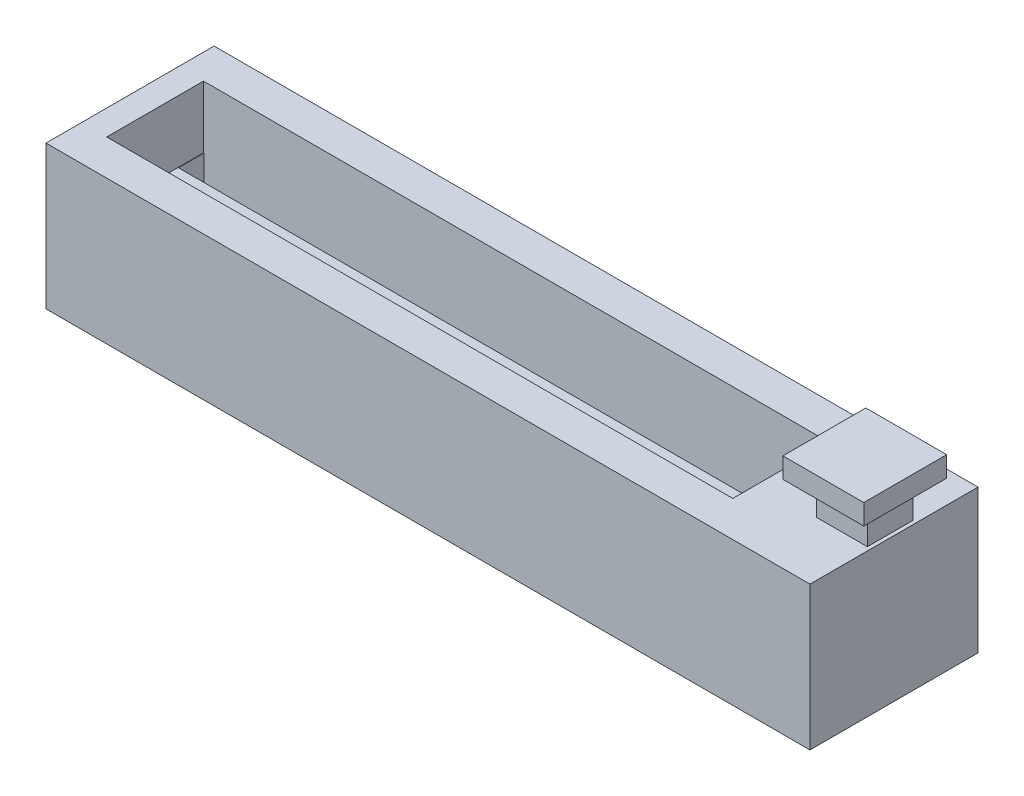
from build123d import *

# Parameters (mm, degrees)
BOSS_EXTRUDE1_DEPTH  = 13
CUT_EXTRUDE1_DEPTH   = 66.5
BOSS_EXTRUDE4_DEPTH  = 6.1
CUT_EXTRUDE2_DEPTH   = 6.1
BOSS_EXTRUDE6_DEPTH  = 2.5
BOSS_EXTRUDE7_DEPTH  = 2.5
BOSS_EXTRUDE8_DEPTH  = 19.1
BOSS_EXTRUDE12_DEPTH = 9.5
BOSS_EXTRUDE13_DEPTH = 2.5
CUT_EXTRUDE4_DEPTH   = 5
CUT_EXTRUDE5_DEPTH   = 6.5
BOSS_EXTRUDE14_DEPTH = 10
CUT_EXTRUDE7_DEPTH   = 13
CUT_EXTRUDE8_DEPTH   = 5
CUT_EXTRUDE9_DEPTH   = 5
BOSS_EXTRUDE15_DEPTH = 2


with BuildPart() as part:
    # 3DSketch1 → Boss-Extrude1 (new body)
    with BuildSketch(Plane(origin=(0, 0, 0), x_dir=(0.970570246541768, 0, 0.2408181814727695), z_dir=(0, 1, 0))):
        Polygon((0, 0), (64.542921395, 16.014409068), (68.516421389, 0), (3.973499994, -16.014409068), align=None)
    extrude(amount=BOSS_EXTRUDE1_DEPTH)

    # 3DSketch2 → Cut-Extrude1 (cut)
    with BuildSketch(Plane(origin=(0, 13, 3.5), x_dir=(0, -0.8073911222578979, 0.59001658934231), z_dir=(1, 0, 0))):
        Polygon((0, 0), (10.496084589, 7.670215661), (11.971126063, 5.651737856), (1.475041473, -2.018477806), align=None)
        Polygon((14.626200715, 2.018477806), (4.130116125, -5.651737856), (5.605157599, -7.670215661), (16.101242188, 0), align=None)
    extrude(amount=CUT_EXTRUDE1_DEPTH, mode=Mode.SUBTRACT)


with BuildPart() as cut_extrude1_piece_1:
    # of the separate pieces the step leaves, piece 1, a body of its own (cut_extrude1_pieces)
    add(part.part.solids().sort_by_distance((0, 0, 10.5))[0])



with BuildPart() as cut_extrude1_piece_2:
    # of the separate pieces the step leaves, piece 2, a body of its own (cut_extrude1_pieces)
    add(part.part.solids().sort_by_distance((0, 0, 16.5))[0])


with BuildPart() as cut_extrude1_piece_3:
    # of the separate pieces the step leaves, piece 3, a body of its own (cut_extrude1_pieces)
    add(part.part.solids().sort_by_distance((0, 0, 0))[0])


with BuildPart() as cut_extrude1_piece_1_1:
    add(cut_extrude1_piece_1.part)

    add(cut_extrude1_piece_2.part)  # Boss-Extrude4 merges Cut-Extrude1 piece 2

    add(cut_extrude1_piece_3.part)  # Boss-Extrude4 merges Cut-Extrude1 piece 3
    # 3DSketch3 → Boss-Extrude4 (add)
    with BuildSketch(Plane(origin=(0, 13, 0), x_dir=(0.970570246541768, 0, 0.2408181814727695), z_dir=(0, 1, 0))):
        Polygon((0, 0), (64.542921395, 16.014409068), (68.516421389, 0), (3.973499994, -16.014409068), align=None)
    extrude(amount=BOSS_EXTRUDE4_DEPTH)

    # 3DSketch4 → Cut-Extrude2 (cut)
    with BuildSketch(Plane(origin=(2.463625992, 19.1, 3.5), x_dir=(0.9882657761690827, 0, 0.15274408549243565), z_dir=(0, 1, 0))):
        Polygon((0, 0), (60.744465433, 9.388524874), (62.195534245, 0), (1.451068812, -9.388524874), align=None)
    extrude(amount=-CUT_EXTRUDE2_DEPTH, mode=Mode.SUBTRACT)

    # 3DSketch5 → Boss-Extrude6 (add)
    with BuildSketch(Plane(origin=(0, 13, 3.5), x_dir=(0, -0.38512437764181645, 0.9228646779165425), z_dir=(-1, 0, 0))):
        Polygon((0, 0), (0.564008213, -1.351519893), (1.526819157, -3.658681588), (3.833980852, -2.695870643), (2.871169908, -0.388708949), (2.307161695, 0.962810944), align=None)
        Polygon((6.460052745, 2.695870643), (7.024060958, 1.344350751), (7.986871902, -0.962810944), (10.294033597, 0), (9.331222653, 2.307161695), (8.76721444, 3.658681588), align=None)
    extrude(amount=-BOSS_EXTRUDE6_DEPTH)

    # 3DSketch6 → Boss-Extrude7 (add)
    with BuildSketch(Plane(origin=(66.5, 0, 13), x_dir=(0, 0.8073911222578979, -0.5900165893423102), z_dir=(-1, 0, 0))):
        Polygon((0, 0), (1.475041473, 2.018477806), (11.971126063, -5.651737856), (10.496084589, -7.670215661), align=None)
        Polygon((14.626200715, -2.018477806), (4.130116125, 5.651737856), (5.605157599, 7.670215661), (16.101242188, 0), align=None)
    extrude(amount=BOSS_EXTRUDE7_DEPTH)

    # 3DSketch7 → Boss-Extrude8 (add)
    with BuildSketch(Plane(origin=(66.5, 0, 0), x_dir=(0.7713732785400773, 0, 0.6363829547955637), z_dir=(0, 1, 0))):
        Polygon((0, 0), (15.427465571, 12.727659096), (25.927784325, 0), (10.500318754, -12.727659096), align=None)
    extrude(amount=BOSS_EXTRUDE8_DEPTH)

    # 3DSketch8 → Boss-Extrude12 (add)
    with BuildSketch(Plane(origin=(76.128891267, 13, 6), x_dir=(-0.9382075830120803, 0, 0.3460730142305674), z_dir=(0, 1, 0))):
        Polygon((0, 0), (1.557328564, 4.221934124), (-1.734607538, 5.436217903), (-3.291936102, 1.214283779), align=None)
    extrude(amount=BOSS_EXTRUDE12_DEPTH)

    # 3DSketch9 → Boss-Extrude13 (add)
    with BuildSketch(Plane(origin=(75.345809824, 22.5, 11.764688466), x_dir=(0.5846855732237681, 0, -0.8112599956018993), z_dir=(0, 1, 0))):
        Polygon((0, 0), (5.702652298, 4.10997528), (8.664764649, 0), (2.962112351, -4.10997528), align=None)
    extrude(amount=BOSS_EXTRUDE13_DEPTH)

    # 3DSketch11 → Cut-Extrude4 (cut)
    with BuildSketch(Plane(origin=(0, 0, 0), x_dir=(0.9822888340033693, 0, 0.18737301457867736), z_dir=(0, -1, 0))):
        Polygon((0, 0), (3.091654741, 16.207765761), (88.059638882, 0), (84.967984141, -16.207765761), align=None)
    extrude(amount=-CUT_EXTRUDE4_DEPTH, mode=Mode.SUBTRACT)

    # 3DSketch12 → Cut-Extrude5 (cut)
    with BuildSketch(Plane(origin=(86.5, 5, 0), x_dir=(0, 0.6496523275821462, 0.7602314471705968), z_dir=(1, 0, 0))):
        Polygon((0, 0), (12.543818878, 10.719263405), (21.703916697, 0), (9.160097819, -10.719263405), align=None)
    extrude(amount=-CUT_EXTRUDE5_DEPTH, mode=Mode.SUBTRACT)

    # 3DSketch13 → Boss-Extrude14 (add)
    with BuildSketch(Plane(origin=(79.637641528, 22.5, 10.5), x_dir=(0, -0.6028330891856902, -0.7978673239222407), z_dir=(-1, 0, 0))):
        Polygon((0, 0), (2.049632503, 2.712748901), (5.640035461, 0), (3.590402958, -2.712748901), align=None)
    extrude(amount=BOSS_EXTRUDE14_DEPTH)

    # 3DSketch14 → Cut-Extrude7 (cut)
    with BuildSketch(Plane(origin=(80.41197271, 22.5, 4.735311534), x_dir=(0, 0.3350889131315588, 0.9421865103557314), z_dir=(-1, 0, 0))):
        Polygon((0, 0), (0.837722283, 2.355466276), (7.460706404, 0), (6.622984121, -2.355466276), align=None)
    extrude(amount=CUT_EXTRUDE7_DEPTH, mode=Mode.SUBTRACT)

    # 3DSketch15 → Cut-Extrude8 (cut)
    with BuildSketch(Plane(origin=(79.637641528, 22.5, 10.5), x_dir=(0, -0.6028330891856902, -0.7978673239222407), z_dir=(-1, 0, 0))):
        Polygon((0, 0), (2.049632503, 2.712748901), (5.640035461, 0), (3.590402958, -2.712748901), align=None)
    extrude(amount=CUT_EXTRUDE8_DEPTH, mode=Mode.SUBTRACT)

    # 3DSketch16 → Cut-Extrude9 (cut)
    with BuildSketch(Plane(origin=(80, 19.1, 0), x_dir=(0, -0.6496523275821462, 0.7602314471705968), z_dir=(-1, 0, 0))):
        Polygon((0, 0), (12.543818878, 10.719263405), (21.703916697, 0), (9.160097819, -10.719263405), align=None)
    extrude(amount=CUT_EXTRUDE9_DEPTH, mode=Mode.SUBTRACT)

    # 3DSketch17 → Boss-Extrude15 (add)
    with BuildSketch(Plane(origin=(68.168662732, 22.5, 12.3202178), x_dir=(0.6981467055639471, 0, -0.7159547314671559), z_dir=(0, -1, 0))):
        Polygon((0, 0), (5.828183385, -5.683218296), (11.370042327, 0), (5.541858942, 5.683218296), align=None)
    extrude(amount=-BOSS_EXTRUDE15_DEPTH)


solid = cut_extrude1_piece_1_1.part
